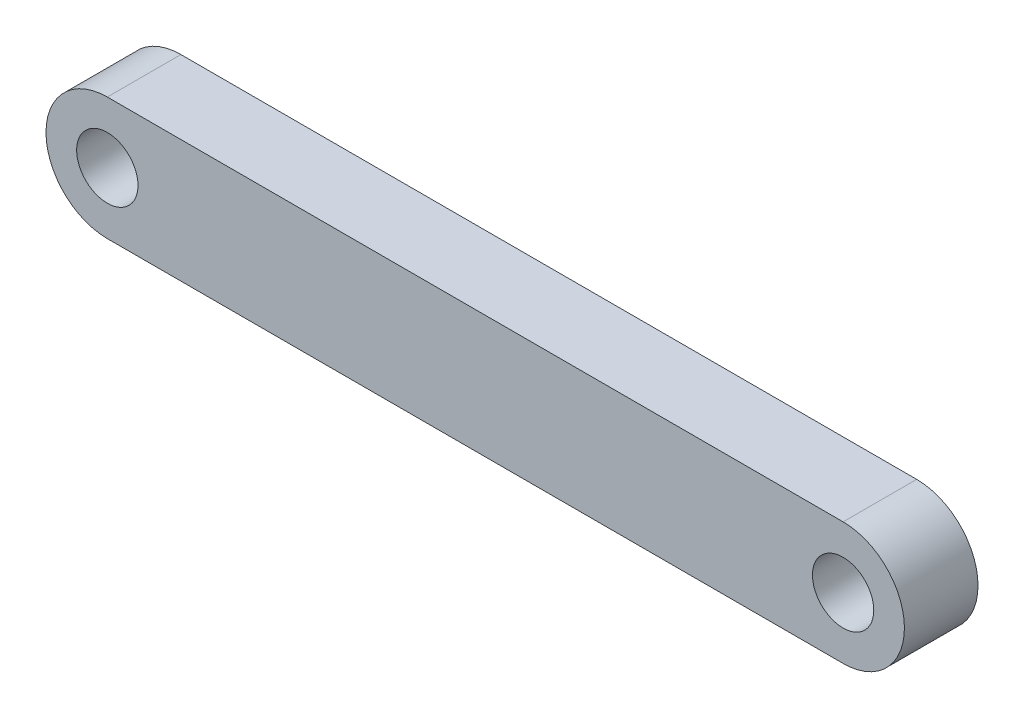
from build123d import *

# Parameters (mm, degrees)
SKETCH1_R           = 2.5
BOSS_EXTRUDE1_DEPTH = 3


with BuildPart() as part:
    # Sketch1 → Boss-Extrude1 (new, symmetric)
    with BuildSketch(Plane.XY):
        with BuildLine():
            Line((-30, 5), (30, 5))
            ThreePointArc((30, 5), (35, 0), (30, -5))
            Line((30, -5), (-30, -5))
            ThreePointArc((-30, -5), (-35, 0), (-30, 5))
        make_face()
        with Locations((-30, 0)):
            Circle(SKETCH1_R, mode=Mode.SUBTRACT)
        with Locations((30, 0)):
            Circle(SKETCH1_R, mode=Mode.SUBTRACT)
    extrude(amount=BOSS_EXTRUDE1_DEPTH, both=True)


solid = part.part
